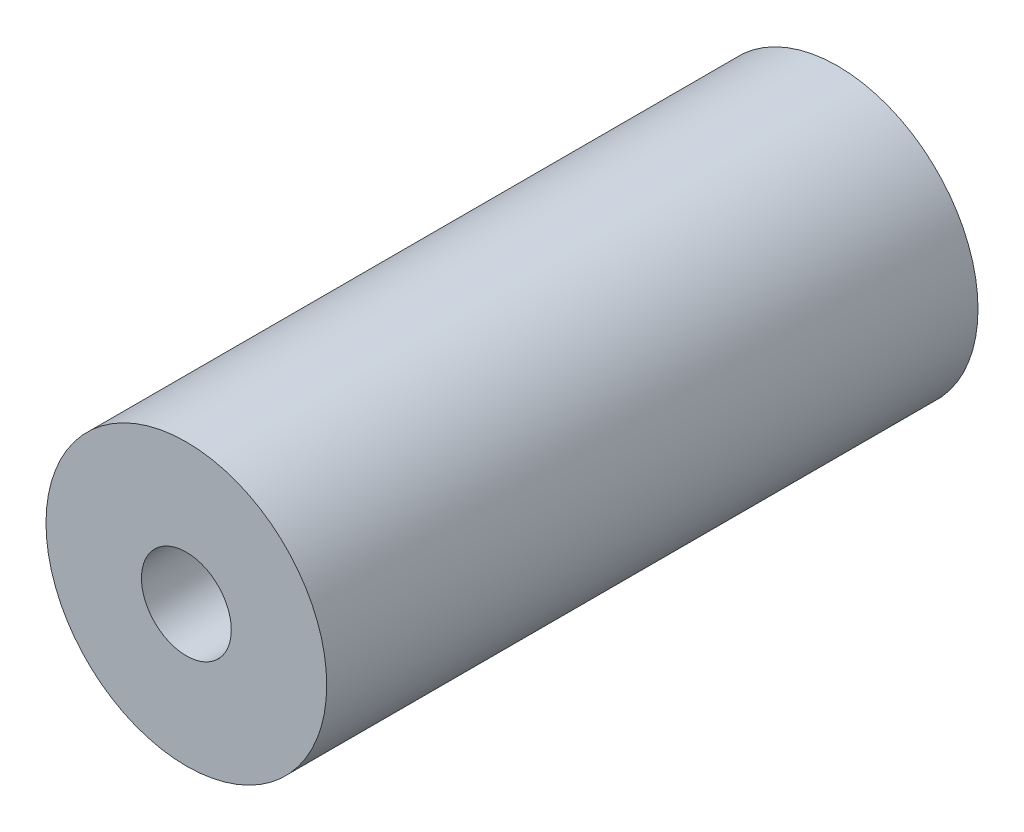
from build123d import *

# Parameters (mm, degrees)
CROQUIS1_R              = 12.5
SALIENTE_EXTRUIR1_DEPTH = 29
CROQUIS2_R              = 4
CORTAR_EXTRUIR1_DEPTH   = 70


with BuildPart() as part:
    # Croquis1 → Saliente-Extruir1 (new, symmetric)
    with BuildSketch(Plane.XY):
        Circle(CROQUIS1_R)
    extrude(amount=SALIENTE_EXTRUIR1_DEPTH, both=True)

    # Croquis2 → Cortar-Extruir1 (cut)
    with BuildSketch(Plane.XY.offset(29)):
        Circle(CROQUIS2_R)
    extrude(amount=-CORTAR_EXTRUIR1_DEPTH, mode=Mode.SUBTRACT)


solid = part.part
